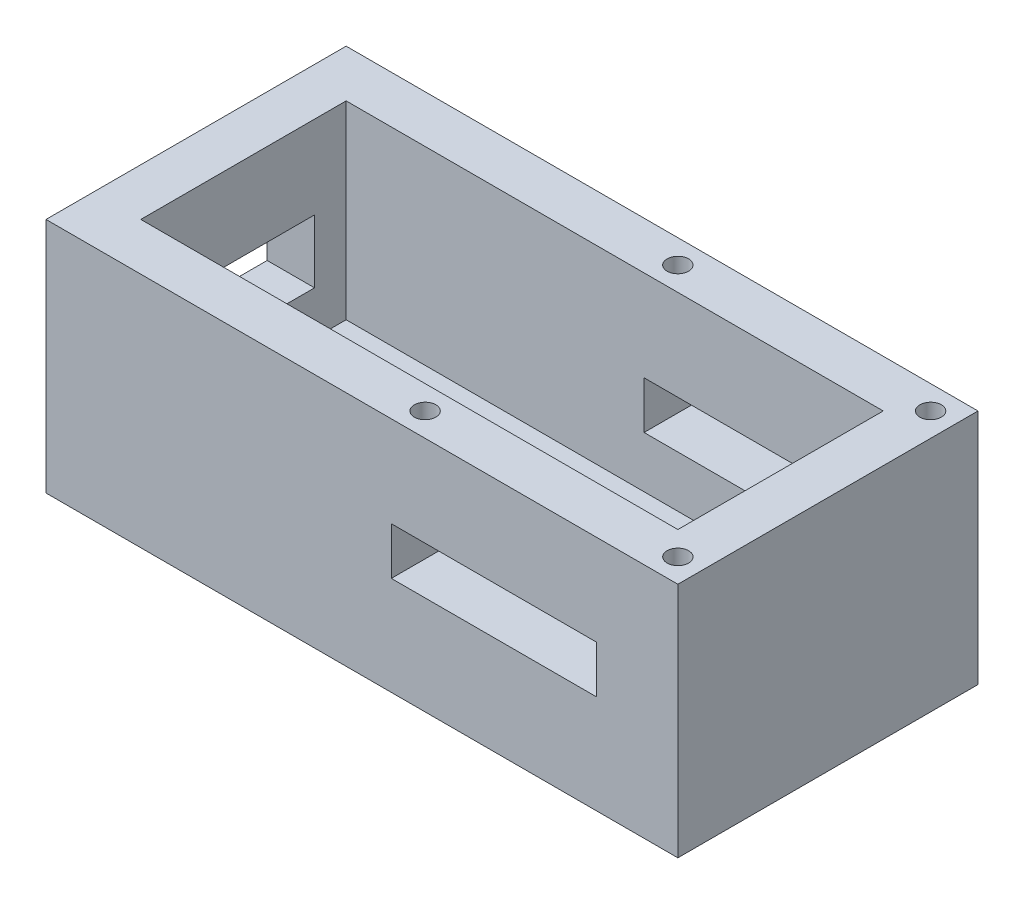
from build123d import *

# Parameters (mm, degrees)
SKETCH1_W                 = 101.6
SKETCH1_H                 = 48.26
BOSS_EXTRUDE1_DEPTH       = 38.1
SHELL1_T                  = -7.62
SKETCH4_W                 = 22.86
SKETCH4_H                 = 10.16
CUT_EXTRUDE1_DEPTH        = 38.1
SKETCH5_W                 = 33.02
SKETCH5_H                 = 7.62
CUT_EXTRUDE2_DEPTH        = 80.757617818
F_8_32_TAPPED_HOLE1_D     = 3.4544
F_8_32_TAPPED_HOLE1_DEPTH = 12.065
F_8_32_TAPPED_HOLE1_TIP   = 1.037806461


with BuildPart() as part:
    # Sketch1 → Boss-Extrude1 (new body)
    with BuildSketch(Plane(origin=(0, 0, 0), x_dir=(1, 0, 0), z_dir=(0, 1, 0))):
        Rectangle(SKETCH1_W, SKETCH1_H)
    extrude(amount=BOSS_EXTRUDE1_DEPTH)

    # Shell1
    shell1_openings = [part.faces().sort_by_distance(p)[0] for p in [
        (0, 38.1, 0),
    ]]
    offset(amount=SHELL1_T, openings=shell1_openings, kind=Kind.INTERSECTION)

    # Sketch4 → Cut-Extrude1 (cut)
    with BuildSketch(Plane.ZY.offset(50.8)):
        with Locations((0, 19.685)):
            Rectangle(SKETCH4_W, SKETCH4_H)
    extrude(amount=-CUT_EXTRUDE1_DEPTH, mode=Mode.SUBTRACT)

    # Sketch5 → Cut-Extrude2 (cut, through all)
    with BuildSketch(Plane(origin=(0, 0, -24.13), x_dir=(-1, 0, 0), z_dir=(0, 0, -1))):
        with Locations((-21.234297506, 19.685)):
            Rectangle(SKETCH5_W, SKETCH5_H)
    extrude(amount=-CUT_EXTRUDE2_DEPTH, mode=Mode.SUBTRACT)

    # #8-32 Tapped Hole1
    with Locations(Plane(origin=(0, 38.1, 0), x_dir=(1, 0, 0), z_dir=(0, 1, 0))):
        with Locations((46.99, -20.32), (26.67, 0), (46.99, 20.32), (6.35, -20.32), (6.35, 20.32)):
            Hole(F_8_32_TAPPED_HOLE1_D / 2, depth=F_8_32_TAPPED_HOLE1_DEPTH)
            with Locations((0, 0, -(F_8_32_TAPPED_HOLE1_DEPTH + F_8_32_TAPPED_HOLE1_TIP / 2))):  # 118° drill point
                Cone(0, F_8_32_TAPPED_HOLE1_D / 2, F_8_32_TAPPED_HOLE1_TIP, mode=Mode.SUBTRACT)


solid = part.part
